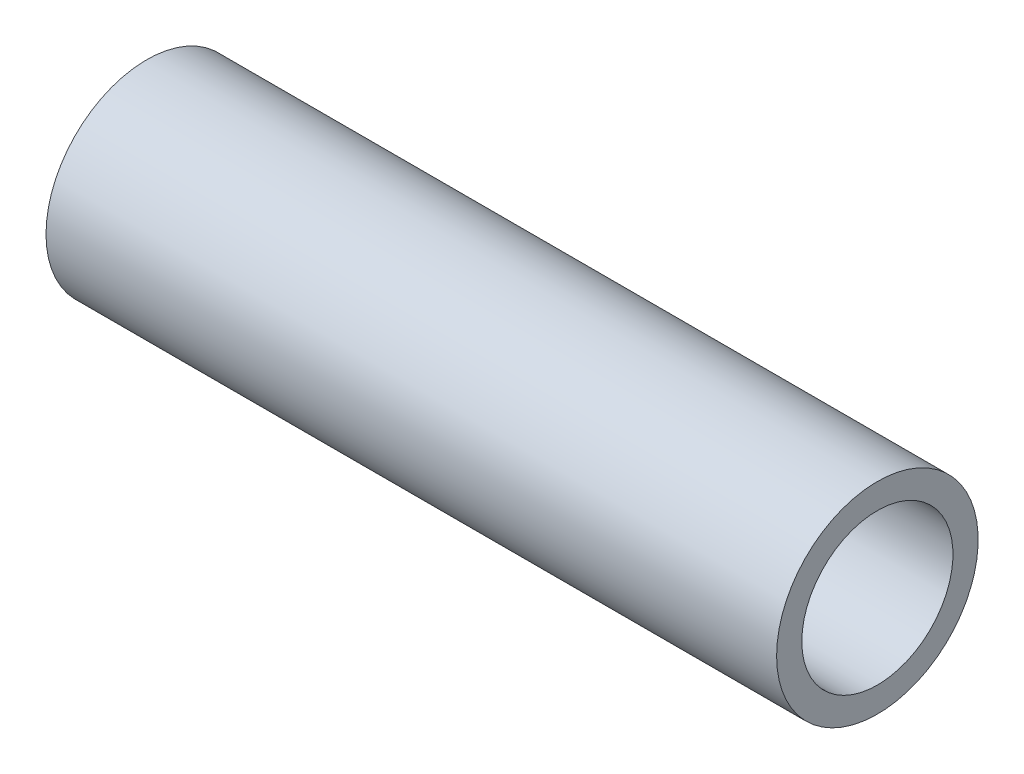
from build123d import *

# Parameters (mm, degrees)
TUBE_PROFILE_R   = 4
TUBE_PROFILE_R_2 = 3


with BuildPart() as part:
    # Tube: sweep along a curve in space
    with BuildLine() as tube_path:
        Line((167, 21, 35), (138, 21, 35))
    # Tube profile (on start of the path) → Tube (sweep)
    with BuildSketch(Plane(origin=(167, 21, 35), x_dir=(0, 0, -1), z_dir=(-1, 0, 0))):
        Circle(TUBE_PROFILE_R)
        Circle(TUBE_PROFILE_R_2, mode=Mode.SUBTRACT)
    sweep(path=tube_path.line)


solid = part.part
